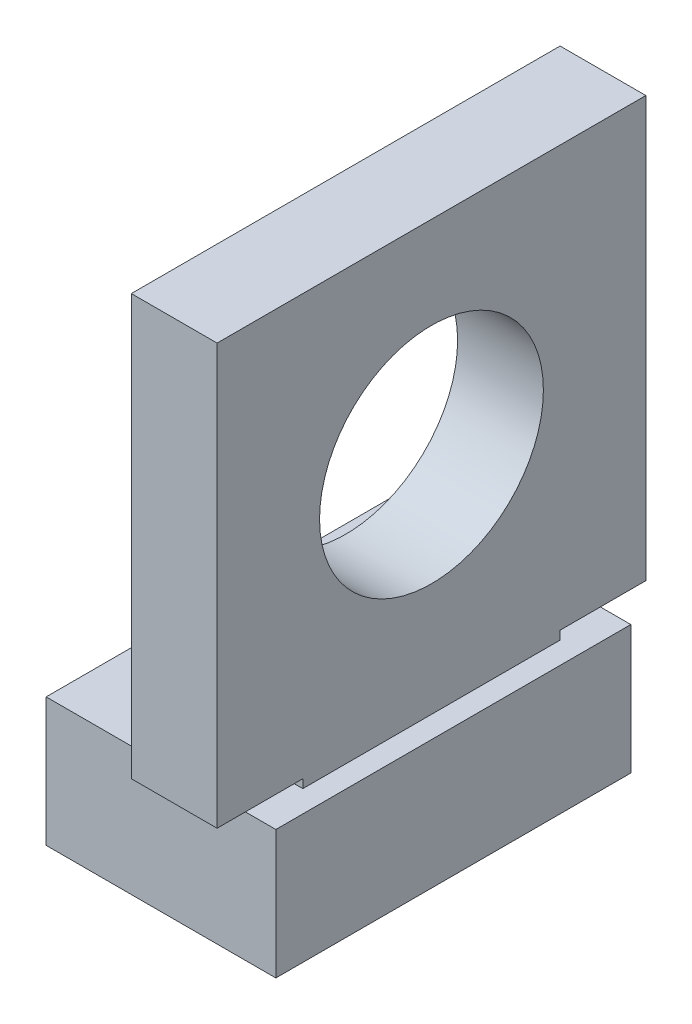
from build123d import *

# Parameters (mm, degrees)
SKETCH1_W           = 280
SKETCH1_H           = 210
BOSS_EXTRUDE1_DEPTH = 15
SKETCH2_R           = 5
BOSS_EXTRUDE2_DEPTH = 50
SKETCH3_W           = 10
SKETCH3_H           = 30
BOSS_EXTRUDE3_DEPTH = 50
SKETCH5_W           = 360.4909063
SKETCH5_H           = 249.182613404
SKETCH5_W_2         = 248.173776912
SKETCH5_H_2         = 125.095724948
CUT_EXTRUDE5_DEPTH  = 15
CUT_EXTRUDE6_START  = -65
SKETCH7_R           = 5
CUT_EXTRUDE6_DEPTH  = 65
SKETCH8_R           = 10
CUT_EXTRUDE7_DEPTH  = 12
SKETCH9_W           = 29.13
SKETCH9_H           = 16.72
CUT_EXTRUDE8_DEPTH  = 15
SKETCH10_W          = 26.78462743
SKETCH10_H          = 41.395526334
CUT_EXTRUDE9_DEPTH  = 27
SKETCH11_W          = 10
SKETCH11_H          = 49
BOSS_EXTRUDE4_DEPTH = 10
SKETCH12_W          = 10
SKETCH12_H          = 49
BOSS_EXTRUDE5_DEPTH = 10
SKETCH4_R           = 13.05
CUT_EXTRUDE10_DEPTH = 74.738133634


with BuildPart() as part:
    # Sketch1 → Boss-Extrude1 (new body)
    with BuildSketch(Plane(origin=(0, 0, 0), x_dir=(1, 0, 0), z_dir=(0, 1, 0))):
        Rectangle(SKETCH1_W, SKETCH1_H)
    extrude(amount=BOSS_EXTRUDE1_DEPTH)

    # Sketch2 → Boss-Extrude2 (add)
    with BuildSketch(Plane(origin=(0, 15, 0), x_dir=(1, 0, 0), z_dir=(0, 1, 0))):
        with Locations(Location((-100, 0, 0), (0, 0, 270))):
            Circle(SKETCH2_R)
        with Locations(Location((-100, 45, 0), (0, 0, 270))):
            Circle(SKETCH2_R)
        with Locations(Location((-100, -45, 0), (0, 0, 270))):
            Circle(SKETCH2_R)
    extrude(amount=BOSS_EXTRUDE2_DEPTH)

    # Sketch3 → Boss-Extrude3 (add)
    with BuildSketch(Plane(origin=(0, 15, 0), x_dir=(1, 0, 0), z_dir=(0, 1, 0))):
        Rectangle(SKETCH3_W, SKETCH3_H)
    extrude(amount=BOSS_EXTRUDE3_DEPTH)

    # Sketch5 → Cut-Extrude5 (cut)
    with BuildSketch(Plane(origin=(0, 0, 0), x_dir=(1, 0, 0), z_dir=(0, 1, 0))):
        with Locations((1.345115322, -3.19464889)):
            Rectangle(SKETCH5_W, SKETCH5_H)
        Rectangle(SKETCH5_W_2, SKETCH5_H_2, mode=Mode.SUBTRACT)
    extrude(amount=CUT_EXTRUDE5_DEPTH, mode=Mode.SUBTRACT)

    # Sketch7 → Cut-Extrude6 (cut)
    with BuildSketch(Plane(origin=(0, 65, 0), x_dir=(1, 0, 0), z_dir=(0, 1, 0)).offset(CUT_EXTRUDE6_START)):
        with Locations(Location((-100, 45, 0), (0, 0, 270))):
            Circle(SKETCH7_R)
        with Locations(Location((-100, 0, 0), (0, 0, 270))):
            Circle(SKETCH7_R)
        with Locations(Location((-100, -45, 0), (0, 0, 270))):
            Circle(SKETCH7_R)
    extrude(amount=CUT_EXTRUDE6_DEPTH, mode=Mode.SUBTRACT)

    # Sketch8 → Cut-Extrude7 (cut)
    with BuildSketch(Plane.XZ):
        with Locations(Location((-100, 45, 0), (0, 0, 270))):
            Circle(SKETCH8_R)
        with Locations(Location((-100, 0, 0), (0, 0, 270))):
            Circle(SKETCH8_R)
        with Locations(Location((-100, -45, 0), (0, 0, 270))):
            Circle(SKETCH8_R)
    extrude(amount=-CUT_EXTRUDE7_DEPTH, mode=Mode.SUBTRACT)

    # Sketch9 → Cut-Extrude8 (cut)
    with BuildSketch(Plane(origin=(0, 15, 0), x_dir=(1, 0, 0), z_dir=(0, 1, 0))):
        with Locations((-48.397782089, 51.271912045)):
            Rectangle(SKETCH9_W, SKETCH9_H)
    extrude(amount=-CUT_EXTRUDE8_DEPTH, mode=Mode.SUBTRACT)

    # Sketch10 → Cut-Extrude9 (cut)
    with BuildSketch(Plane(origin=(0, 15, 0), x_dir=(1, 0, 0), z_dir=(0, 1, 0))):
        Polygon((10.617962241, 62.547862474), (-124.086888456, 62.547862474), (-124.086888456, -62.547862474), (10.617962241, -62.547862474), (124.086888456, -62.547862474), (124.086888456, 62.547862474), align=None)
        with Locations((-5.842214377, 0)):
            Rectangle(SKETCH10_W, SKETCH10_H, mode=Mode.SUBTRACT)
    extrude(amount=-CUT_EXTRUDE9_DEPTH, mode=Mode.SUBTRACT)

    # Sketch11 → Boss-Extrude4 (add)
    with BuildSketch(Plane(origin=(0, 0, -15), x_dir=(-1, 0, 0), z_dir=(0, 0, -1))):
        with Locations((0, 40.5)):
            Rectangle(SKETCH11_W, SKETCH11_H)
    extrude(amount=BOSS_EXTRUDE4_DEPTH)

    # Sketch12 → Boss-Extrude5 (add)
    with BuildSketch(Plane.XY.offset(15)):
        with Locations((0, 40.5)):
            Rectangle(SKETCH12_W, SKETCH12_H)
    extrude(amount=BOSS_EXTRUDE5_DEPTH)

    # Sketch4 → Cut-Extrude10 (cut, through all)
    with BuildSketch(Plane(origin=(5, 0, 0), x_dir=(0, 0, -1), z_dir=(1, 0, 0))):
        with Locations((0, 41.236240869)):
            Circle(SKETCH4_R)
    extrude(amount=-CUT_EXTRUDE10_DEPTH, mode=Mode.SUBTRACT)


solid = part.part
